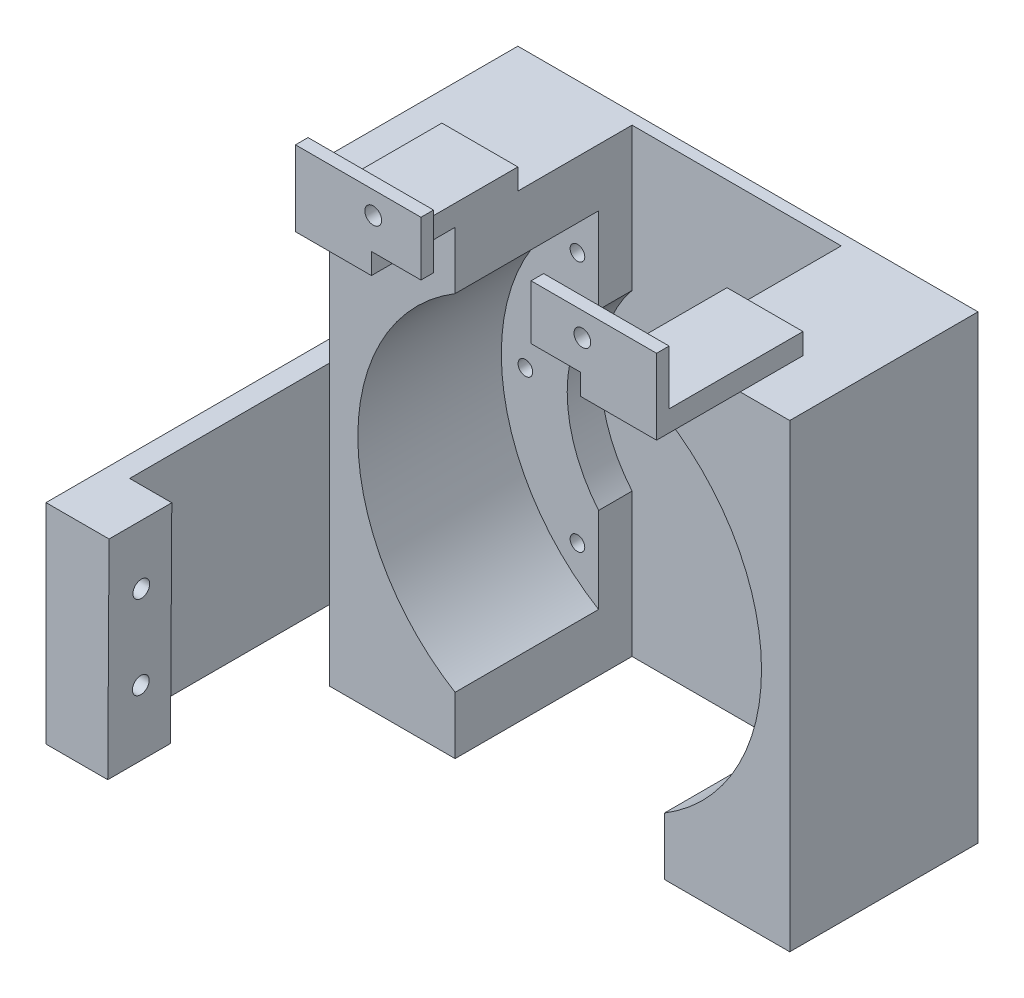
from build123d import *

# Parameters (mm, degrees)
SKETCH_1_W          = 110
SKETCH_1_H          = 110
EXTRUDE_1_DEPTH     = 45
SKETCH_4_R          = 32.5
CUT_EXTRUDE_1_DEPTH = 42.3
SKETCH_5_R          = 48.25
CUT_EXTRUDE_2_DEPTH = 34.3
SKETCH_6_W          = 50
SKETCH_6_H          = 110
CUT_EXTRUDE_3_DEPTH = 8
CUT_EXTRUDE_4_DEPTH = 42.3
SKETCH_8_R          = 1.75
CUT_EXTRUDE_5_DEPTH = 160.3
SKETCH_9_W          = 18.158603558
SKETCH_9_H          = 15
SKETCH_9_H_2        = 20
EXTRUDE_2_DEPTH     = 5
SKETCH_10_W         = 30
SKETCH_10_H         = 3
EXTRUDE_3_DEPTH     = 13
SKETCH_11_R         = 2
CUT_EXTRUDE_6_DEPTH = 168.463428843
SKETCH_12_W         = 85
SKETCH_12_H         = 50
EXTRUDE_4_DEPTH     = 5
EXTRUDE_5_REACH     = 191.262
SKETCH_13_W         = 15
SKETCH_13_H         = 50
CUT_EXTRUDE_8_REACH = 194.211
SKETCH_15_RX        = 2
SKETCH_15_RY        = 1.999994073


with BuildPart() as part:
    # 草图1 → 凸台-拉伸1 (new body)
    with BuildSketch(Plane.XY):
        with Locations((55, -55)):
            Rectangle(SKETCH_1_W, SKETCH_1_H)
    extrude(amount=EXTRUDE_1_DEPTH)

    # 草图4 → 切除-拉伸1 (cut)
    with BuildSketch(Plane.XY.offset(45)):
        with Locations((55, -55)):
            Circle(SKETCH_4_R)
    extrude(amount=-CUT_EXTRUDE_1_DEPTH, mode=Mode.SUBTRACT)

    # 草图5 → 切除-拉伸2 (cut)
    with BuildSketch(Plane.XY.offset(45)):
        with Locations((55, -55)):
            Circle(SKETCH_5_R)
    extrude(amount=-CUT_EXTRUDE_2_DEPTH, mode=Mode.SUBTRACT)

    # 草图6 → 切除-拉伸3 (cut)
    with BuildSketch(Plane.XY.offset(10.7)):
        with Locations((55, -55)):
            Rectangle(SKETCH_6_W, SKETCH_6_H)
    extrude(amount=-CUT_EXTRUDE_3_DEPTH, mode=Mode.SUBTRACT)

    # 草图7 → 切除-拉伸4 (cut)
    with BuildSketch(Plane.XY.offset(45)):
        with BuildLine():
            Line((80, -34.233440343), (80, 0))
            Line((80, 0), (30, 0))
            Line((30, 0), (30, -34.233440343))
            ThreePointArc((30, -34.233440343), (22.5, -55), (30, -75.766559657))
            Line((30, -75.766559657), (30, -110))
            Line((30, -110), (80, -110))
            Line((80, -110), (80, -75.766559657))
            ThreePointArc((80, -75.766559657), (87.5, -55), (80, -34.233440343))
        make_face()
    extrude(amount=-CUT_EXTRUDE_4_DEPTH, mode=Mode.SUBTRACT)

    # 草图8 → 切除-拉伸5 (cut, through all)
    with BuildSketch(Plane.XY.offset(10.7)):
        with Locations((12.5, -55)):
            Circle(SKETCH_8_R)
        with Locations((24.9479618, -24.9479618)):
            Circle(SKETCH_8_R)
        with Locations((85.0520382, -24.9479618)):
            Circle(SKETCH_8_R)
        with Locations((97.5, -55)):
            Circle(SKETCH_8_R)
        with Locations((85.0520382, -85.0520382)):
            Circle(SKETCH_8_R)
        with Locations((24.9479618, -85.0520382)):
            Circle(SKETCH_8_R)
    extrude(amount=-CUT_EXTRUDE_5_DEPTH, mode=Mode.SUBTRACT)

    # 草图9 → 凸台-拉伸2 (add)
    with BuildSketch(Plane(origin=(0, 0, 0), x_dir=(1, 0, 0), z_dir=(0, 1, 0))):
        with Locations((20.920698221, -37.5)):
            Rectangle(SKETCH_9_W, SKETCH_9_H)
        with Locations((20.920698221, -55)):
            Rectangle(SKETCH_9_W, SKETCH_9_H_2)
        with Locations((89.079301779, -37.5)):
            Rectangle(SKETCH_9_W, SKETCH_9_H)
        with Locations((89.079301779, -55)):
            Rectangle(SKETCH_9_W, SKETCH_9_H_2)
    extrude(amount=EXTRUDE_2_DEPTH)

    # 草图10 → 凸台-拉伸3 (add)
    with BuildSketch(Plane(origin=(0, 5, 0), x_dir=(1, 0, 0), z_dir=(0, 1, 0))):
        with Locations((83.158603558, -63.5)):
            Rectangle(SKETCH_10_W, SKETCH_10_H)
        with Locations((26.841396442, -63.5)):
            Rectangle(SKETCH_10_W, SKETCH_10_H)
    extrude(amount=EXTRUDE_3_DEPTH)

    # 草图11 → 切除-拉伸6 (cut, through all)
    with BuildSketch(Plane(origin=(0, 0, 62), x_dir=(-1, 0, 0), z_dir=(0, 0, -1))):
        with Locations((-30.425668719, 12.656132332)):
            Circle(SKETCH_11_R)
        with Locations((-80.424676819, 12.34118954)):
            Circle(SKETCH_11_R)
    extrude(amount=-CUT_EXTRUDE_6_DEPTH, mode=Mode.SUBTRACT)

    # 草图12 → 凸台-拉伸4 (add)
    with BuildSketch(Plane.ZY):
        with Locations((65.296402905, -68.092997568)):
            Rectangle(SKETCH_12_W, SKETCH_12_H)
    extrude(amount=EXTRUDE_4_DEPTH)

    # 凸台-拉伸5: up to this plane
    extrude_5_end = Plane(origin=(9.859168453, -77.216105133, 215), z_dir=(-0.9999801620108199, 0.006298855833765048, 1.0454600148553557e-15))
    # 草图13 → 凸台-拉伸5 (add, up to the surface)
    with BuildSketch(Plane(origin=(0, 0, 0), x_dir=(0, 0, -1), z_dir=(1, 0, 0)), mode=Mode.PRIVATE) as extrude_5_sk1:
        with Locations((-100.296402905, -68.092997568)):
            Rectangle(SKETCH_13_W, SKETCH_13_H)
    extrude_5_tool1 = split(extrude(extrude_5_sk1.sketch, amount=EXTRUDE_5_REACH, mode=Mode.PRIVATE), bisect_by=extrude_5_end, keep=Keep.BOTH, mode=Mode.PRIVATE)
    add(extrude_5_tool1.solids().sort_by_distance((0, -68.092998, 100.296403))[0])

    # 切除-拉伸8: up to this plane
    cut_extrude_8_end = Plane(origin=(9.859168453, -77.216105133, 215), z_dir=(-0.9999801620108199, 0.006298855833765048, 1.0454600148553557e-15))
    # 草图15 → 切除-拉伸8 (cut, up to the surface)
    with BuildSketch(Plane.ZY.offset(5), mode=Mode.PRIVATE) as cut_extrude_8_sk1:
        with Locations(Location((100, -57.347927742), (0, 0, -180))):
            Ellipse(SKETCH_15_RX, SKETCH_15_RY)
    cut_extrude_8_tool1 = split(extrude(cut_extrude_8_sk1.sketch, amount=-CUT_EXTRUDE_8_REACH, mode=Mode.PRIVATE), bisect_by=cut_extrude_8_end, keep=Keep.BOTH, mode=Mode.PRIVATE)
    add(cut_extrude_8_tool1.solids().sort_by_distance((-5, -57.347928, 100))[0], mode=Mode.SUBTRACT)
    # 草图15 → 切除-拉伸8 (cut, up to the surface)
    with BuildSketch(Plane.ZY.offset(5), mode=Mode.PRIVATE) as cut_extrude_8_sk2:
        with BuildLine():
            add(Edge.make_bspline(
                [(102, -77.347868558), (102.000000089, -75.347874441), (100.000000045, -75.347874396), (98, -75.347874352), (98, -77.347868469)],
                knots=[3.141592609, 3.141592609, 3.141592609, 4.712388958, 4.712388958, 6.283185307, 6.283185307, 6.283185307], degree=2, weights=[1, 0.707106773, 1, 0.707106773, 1]))
            add(Edge.make_bspline(
                [(98, -77.347868469), (98, -79.347862497), (99.999999955, -79.347862542), (101.999999911, -79.347862586), (102, -77.347868558)],
                knots=[0, 0, 0, 1.570796304, 1.570796304, 3.141592609, 3.141592609, 3.141592609], degree=2, weights=[1, 0.707106789, 1, 0.707106789, 1]))
        make_face()
    cut_extrude_8_tool2 = split(extrude(cut_extrude_8_sk2.sketch, amount=-CUT_EXTRUDE_8_REACH, mode=Mode.PRIVATE), bisect_by=cut_extrude_8_end, keep=Keep.BOTH, mode=Mode.PRIVATE)
    add(cut_extrude_8_tool2.solids().sort_by_distance((-5, -77.347868, 100))[0], mode=Mode.SUBTRACT)


solid = part.part
